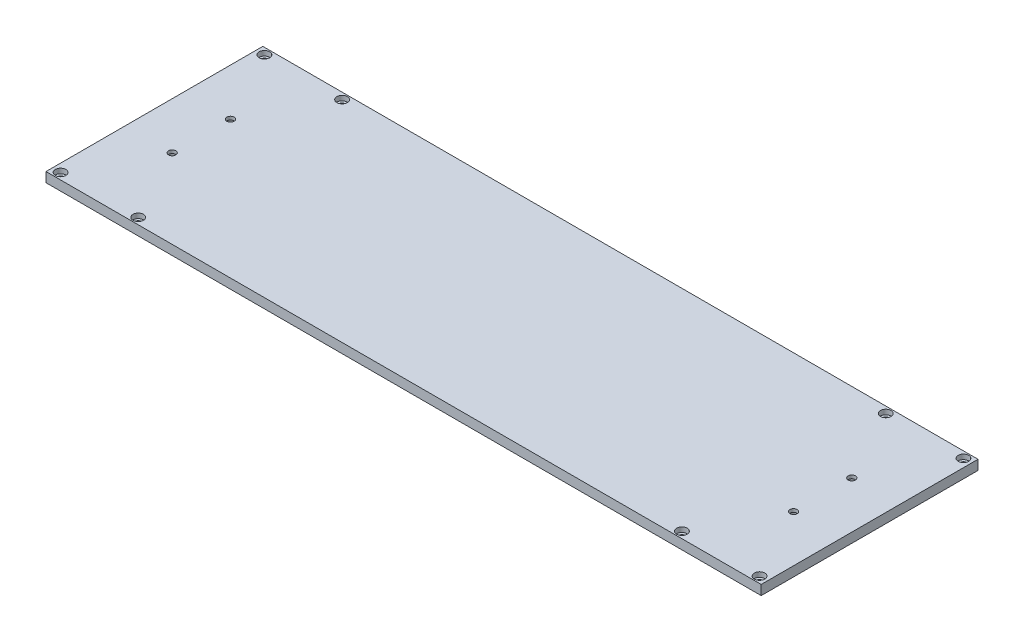
from build123d import *

# Parameters (mm, degrees)
SKETCH1_W                     = 442
SKETCH1_H                     = 134
BOSS_EXTRUDE1_DEPTH           = 6
CBORE_FOR_M3_SHCS2_AT_2_COUNT = 2
CBORE_FOR_M3_SHCS2_AT_2_PITCH = 48
CBORE_FOR_M3_SHCS2_AT_3_COUNT = 2
CBORE_FOR_M3_SHCS2_AT_3_PITCH = 134.833230325
CBORE_FOR_M3_SHCS2_AT_4_COUNT = 2
CBORE_FOR_M3_SHCS2_AT_4_PITCH = 126
CBORE_FOR_M4_SHCS1_AT_2_COUNT = 2
CBORE_FOR_M4_SHCS1_AT_2_PITCH = 36
LPATTERN1_COUNT               = 2
LPATTERN1_PITCH               = 384


with BuildPart() as part:
    # Sketch1 → Boss-Extrude1 (new body)
    with BuildSketch(Plane(origin=(0, 0, 0), x_dir=(1, 0, 0), z_dir=(0, 1, 0))):
        Rectangle(SKETCH1_W, SKETCH1_H)
    extrude(amount=BOSS_EXTRUDE1_DEPTH)

    # Sketch3 → CBORE for M3 SHCS2 (revolve, cut)
    with BuildSketch(Plane(origin=(216, 6, -63), x_dir=(0, 0, 1), z_dir=(1, 0, 0))):
        Polygon((0, 0), (0, 18.401463052), (1.7, 17.38), (1.7, 3), (3.25, 3), (3.25, 0), align=None)
    cbore_for_m3_shcs2 = revolve(axis=Axis((216, 12.35, -63), (0, -1, 0)), mode=Mode.SUBTRACT)

    # CBORE for M3 SHCS2 at 2: CBORE for M3 SHCS2 ×2
    with Locations(*[(-i * CBORE_FOR_M3_SHCS2_AT_2_PITCH, 0, 0) for i in range(1, CBORE_FOR_M3_SHCS2_AT_2_COUNT)]):
        add(cbore_for_m3_shcs2, mode=Mode.SUBTRACT)

    # CBORE for M3 SHCS2 at 3: CBORE for M3 SHCS2 ×2
    with Locations(*[Vector(-0.35599532759198804, 0, 0.9344877349289681) * (i * CBORE_FOR_M3_SHCS2_AT_3_PITCH) for i in range(1, CBORE_FOR_M3_SHCS2_AT_3_COUNT)]):
        add(cbore_for_m3_shcs2, mode=Mode.SUBTRACT)

    # CBORE for M3 SHCS2 at 4: CBORE for M3 SHCS2 ×2
    with Locations(*[(0, 0, i * CBORE_FOR_M3_SHCS2_AT_4_PITCH) for i in range(1, CBORE_FOR_M3_SHCS2_AT_4_COUNT)]):
        add(cbore_for_m3_shcs2, mode=Mode.SUBTRACT)

    # Sketch6 → CBORE for M4 SHCS1 (revolve, cut)
    with BuildSketch(Plane(origin=(192, 0, 18), x_dir=(0, 0, -1), z_dir=(1, 0, 0))):
        Polygon((0, 0), (0, 11.351936393), (2.25, 10), (2.25, 4), (4, 4), (4, 0), align=None)
    cbore_for_m4_shcs1 = revolve(axis=Axis((192, -6.35, 18), (0, 1, 0)), mode=Mode.SUBTRACT)

    # CBORE for M4 SHCS1 at 2: CBORE for M4 SHCS1 ×2
    with Locations(*[(0, 0, -i * CBORE_FOR_M4_SHCS1_AT_2_PITCH) for i in range(1, CBORE_FOR_M4_SHCS1_AT_2_COUNT)]):
        add(cbore_for_m4_shcs1, mode=Mode.SUBTRACT)

    # LPattern1: CBORE for M3 SHCS2, CBORE for M4 SHCS1 ×2
    with Locations(*[(-i * LPATTERN1_PITCH, 0, 0) for i in range(1, LPATTERN1_COUNT)]):
        add(cbore_for_m3_shcs2, mode=Mode.SUBTRACT)
        add(cbore_for_m4_shcs1, mode=Mode.SUBTRACT)

    # LPattern1 copy 1 sketch → LPattern1 copy 1 (revolve, cut)
    with BuildSketch(Plane(origin=(-216, 6, -63), x_dir=(0, 0, 1), z_dir=(1, 0, 0))):
        Polygon((0, 0), (0, 18.401463052), (1.7, 17.38), (1.7, 3), (3.25, 3), (3.25, 0), align=None)
    revolve(axis=Axis((-216, 12.35, -63), (0, -1, 0)), mode=Mode.SUBTRACT)

    # LPattern1 copy 2 sketch → LPattern1 copy 2 (revolve, cut)
    with BuildSketch(Plane(origin=(-216, 6, 63), x_dir=(0, 0, 1), z_dir=(1, 0, 0))):
        Polygon((0, 0), (0, 18.401463052), (1.7, 17.38), (1.7, 3), (3.25, 3), (3.25, 0), align=None)
    revolve(axis=Axis((-216, 12.35, 63), (0, -1, 0)), mode=Mode.SUBTRACT)

    # LPattern1 copy 3 sketch → LPattern1 copy 3 (revolve, cut)
    with BuildSketch(Plane(origin=(-168, 6, 63), x_dir=(0, 0, 1), z_dir=(1, 0, 0))):
        Polygon((0, 0), (0, 18.401463052), (1.7, 17.38), (1.7, 3), (3.25, 3), (3.25, 0), align=None)
    revolve(axis=Axis((-168, 12.35, 63), (0, -1, 0)), mode=Mode.SUBTRACT)

    # LPattern1 copy 4 sketch → LPattern1 copy 4 (revolve, cut)
    with BuildSketch(Plane(origin=(-192, 0, -18), x_dir=(0, 0, -1), z_dir=(1, 0, 0))):
        Polygon((0, 0), (0, 11.351936393), (2.25, 10), (2.25, 4), (4, 4), (4, 0), align=None)
    revolve(axis=Axis((-192, -6.35, -18), (0, 1, 0)), mode=Mode.SUBTRACT)


solid = part.part
